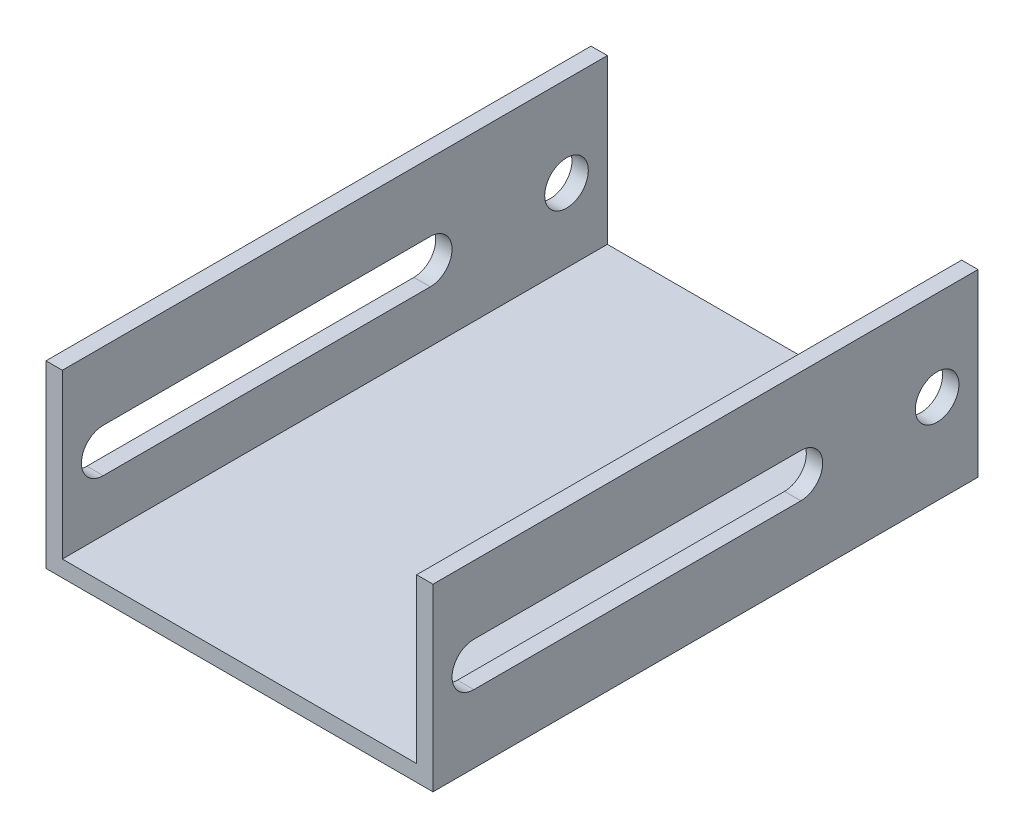
from build123d import *

# Parameters (mm, degrees)
SKETCH_1_W          = 71
SKETCH_1_H          = 100
EXTRUDE_1_DEPTH     = 3
SKETCH_2_W          = 3
SKETCH_2_H          = 100
EXTRUDE_2_DEPTH     = 30
CUT_EXTRUDE_1_REACH = 94.898
SKETCH_3_R          = 4


with BuildPart() as part:
    # 草图1 → 凸台-拉伸1 (new body)
    with BuildSketch(Plane(origin=(0, 0, 0), x_dir=(1, 0, 0), z_dir=(0, 1, 0))):
        Rectangle(SKETCH_1_W, SKETCH_1_H)
    extrude(amount=EXTRUDE_1_DEPTH)

    # 草图2 → 凸台-拉伸2 (add)
    with BuildSketch(Plane(origin=(0, 3, 0), x_dir=(1, 0, 0), z_dir=(0, 1, 0))):
        with Locations((-34, 0)):
            Rectangle(SKETCH_2_W, SKETCH_2_H)
        with Locations((34, 0)):
            Rectangle(SKETCH_2_W, SKETCH_2_H)
    extrude(amount=EXTRUDE_2_DEPTH)

    # 切除-拉伸1: up to this face of the body (flat: up to its plane)
    cut_extrude_1_end = Plane(part.part.faces().sort_by_distance((-35.5, 16.5, 0))[0])
    # 草图3 → 切除-拉伸1 (cut, up to the picked face)
    with BuildSketch(Plane(origin=(35.5, 0, 0), x_dir=(0, 0, -1), z_dir=(1, 0, 0)), mode=Mode.PRIVATE) as cut_extrude_1_sk1:
        with Locations((42.5, 16.5)):
            Circle(SKETCH_3_R)
    cut_extrude_1_tool1 = split(extrude(cut_extrude_1_sk1.sketch, amount=-CUT_EXTRUDE_1_REACH, mode=Mode.PRIVATE), bisect_by=cut_extrude_1_end, keep=Keep.BOTH, mode=Mode.PRIVATE)
    # 草图3 → 切除-拉伸1 (cut, up to the picked face)
    with BuildSketch(Plane(origin=(35.5, 0, 0), x_dir=(0, 0, -1), z_dir=(1, 0, 0)), mode=Mode.PRIVATE) as cut_extrude_1_sk2:
        with BuildLine():
            Line((-42.5, 12.5), (17.5, 12.5))
            ThreePointArc((17.5, 12.5), (21.5, 16.5), (17.5, 20.5))
            Line((17.5, 20.5), (-42.5, 20.5))
            ThreePointArc((-42.5, 20.5), (-46.5, 16.5), (-42.5, 12.5))
        make_face()
    cut_extrude_1_tool2 = split(extrude(cut_extrude_1_sk2.sketch, amount=-CUT_EXTRUDE_1_REACH, mode=Mode.PRIVATE), bisect_by=cut_extrude_1_end, keep=Keep.BOTH, mode=Mode.PRIVATE)
    add(cut_extrude_1_tool1.solids().sort_by(Axis((35.5, 16.5, -42.5), (-1, 0, 0)))[0], mode=Mode.SUBTRACT)
    add(cut_extrude_1_tool2.solids().sort_by(Axis((35.5, 16.5, 12.5), (-1, 0, 0)))[0], mode=Mode.SUBTRACT)


solid = part.part
